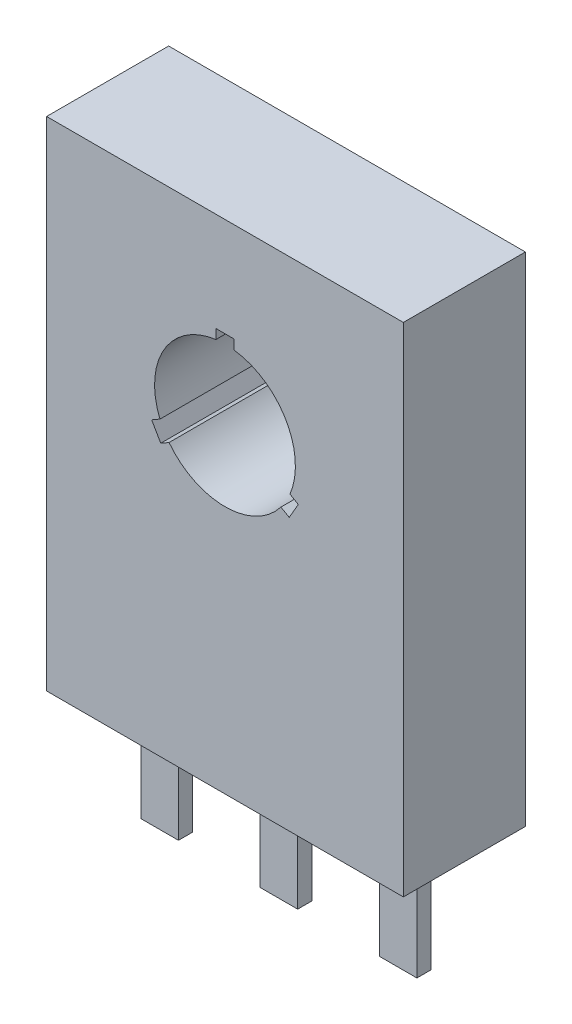
from build123d import *

# Parameters (mm, degrees)
ESBO_O1_W                = 7.6
ESBO_O1_H                = 10.6
ESBO_O1_R                = 1.5
RESSALTO_EXTRUS_O1_DEPTH = 2.6
ESBO_O2_W                = 0.386988846
ESBO_O2_H                = 1.141626943
CORTE_EXTRUS_O1_DEPTH    = 2.4
PADR_OCIRCULAR1_COUNT    = 3
CORTE_EXTRUS_O2_DEPTH    = 0.05
ESBO_O4_W                = 0.8
ESBO_O4_H                = 0.302387696
RESSALTO_EXTRUS_O2_DEPTH = 2.5


with BuildPart() as part:
    # Esboço1 → Ressalto-extrusão1 (new body)
    with BuildSketch(Plane.XY):
        Rectangle(ESBO_O1_W, ESBO_O1_H)
        with Locations((0, 1.5)):
            Circle(ESBO_O1_R, mode=Mode.SUBTRACT)
    extrude(amount=RESSALTO_EXTRUS_O1_DEPTH)

    # Esboço2 → Corte-extrusão1 (cut)
    with BuildSketch(Plane.XY.offset(2.6)):
        with Locations((0, 2.620892828)):
            Rectangle(ESBO_O2_W, ESBO_O2_H)
    corte_extrus_o1 = extrude(amount=-CORTE_EXTRUS_O1_DEPTH, mode=Mode.SUBTRACT)

    # PadrãoCircular1: Corte-extrusão1 ×3 about axis
    padr_ocircular1_axis = Axis((0, 1.5, 0), (0, 0, 1))
    for i in range(1, PADR_OCIRCULAR1_COUNT):
        add(corte_extrus_o1.rotate(padr_ocircular1_axis, i * 360 / PADR_OCIRCULAR1_COUNT), mode=Mode.SUBTRACT)

    # Esboço3 → Corte-extrusão2 (cut)
    with BuildSketch(Plane(origin=(0, 0, 0), x_dir=(-1, 0, 0), z_dir=(0, 0, -1))):
        with BuildLine():
            Line((-1.7, -3.5), (1.7, -3.5))
            ThreePointArc((1.7, -3.5), (2.407106781, -3.207106781), (2.7, -2.5))
            Line((2.7, -2.5), (2.7, 3))
            ThreePointArc((2.7, 3), (2.407106781, 3.707106781), (1.7, 4))
            Line((1.7, 4), (-1.7, 4))
            ThreePointArc((-1.7, 4), (-2.407106781, 3.707106781), (-2.7, 3))
            Line((-2.7, 3), (-2.7, -2.5))
            ThreePointArc((-2.7, -2.5), (-2.407106781, -3.207106781), (-1.7, -3.5))
        make_face()
    extrude(amount=-CORTE_EXTRUS_O2_DEPTH, mode=Mode.SUBTRACT)

    # Esboço4 → Ressalto-extrusão2 (add)
    with BuildSketch(Plane.XZ.offset(5.3)):
        with Locations((-2.54, 1.3)):
            Rectangle(ESBO_O4_W, ESBO_O4_H)
        with Locations((0, 1.3)):
            Rectangle(ESBO_O4_W, ESBO_O4_H)
        with Locations((2.54, 1.3)):
            Rectangle(ESBO_O4_W, ESBO_O4_H)
    extrude(amount=RESSALTO_EXTRUS_O2_DEPTH)


solid = part.part
